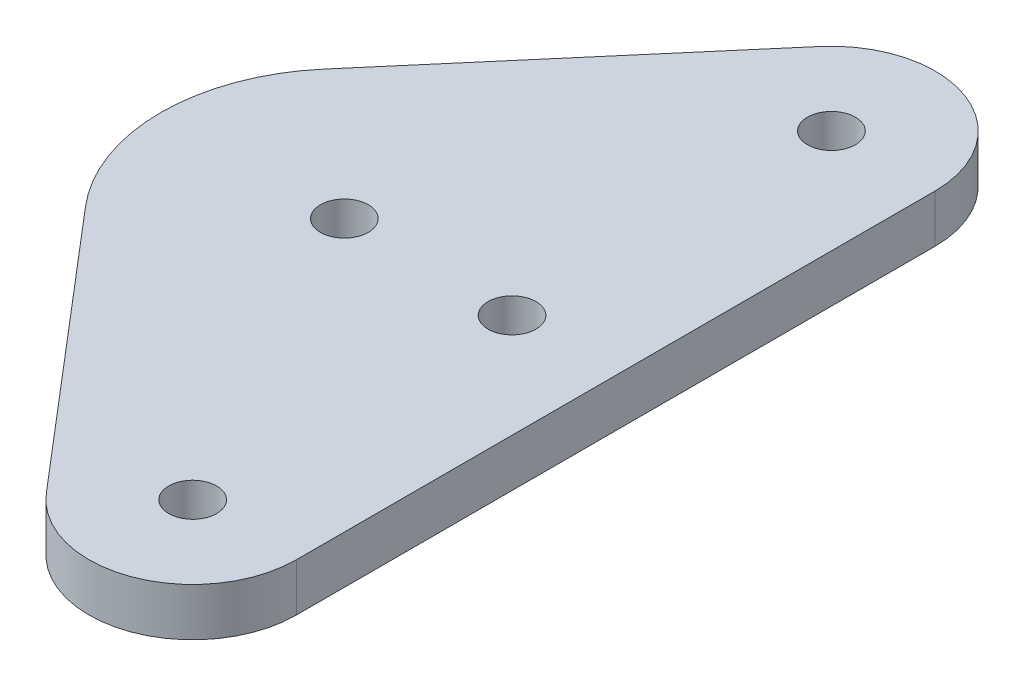
from build123d import *

# Parameters (mm, degrees)
SKETCH_1_R      = 1.5
EXTRUDE_1_DEPTH = 3


with BuildPart() as part:
    # ｽｹｯﾁ1 → ﾎﾞｽ - 押し出し1 (new body)
    with BuildSketch(Plane(origin=(0, 0, 0), x_dir=(1, 0, 0), z_dir=(0, 1, 0))):
        with BuildLine():
            Line((6.5, 20), (6.5, 0))
            Line((6.5, 0), (6.5, -20))
            ThreePointArc((6.5, -20), (2.24911051, -26.098483575), (-4.94353905, -24.220358001))
            Line((-4.94353905, -24.220358001), (-19.246261396, -7.466787233))
            ThreePointArc((-19.246261396, -7.466787233), (-22, 0), (-19.246261396, 7.466787233))
            Line((-19.246261396, 7.466787233), (-4.94353905, 24.220358001))
            ThreePointArc((-4.94353905, 24.220358001), (2.24911051, 26.098483575), (6.5, 20))
        make_face()
        with Locations(Location((0, 0, 0), (0, 0, 270))):
            Circle(SKETCH_1_R, mode=Mode.SUBTRACT)
        with Locations(Location((0, 20, 0), (0, 0, 270))):
            Circle(SKETCH_1_R, mode=Mode.SUBTRACT)
        with Locations(Location((0, -20, 0), (0, 0, 270))):
            Circle(SKETCH_1_R, mode=Mode.SUBTRACT)
        with Locations(Location((-10.5, 0, 0), (0, 0, 270))):
            Circle(SKETCH_1_R, mode=Mode.SUBTRACT)
    extrude(amount=EXTRUDE_1_DEPTH)


solid = part.part
